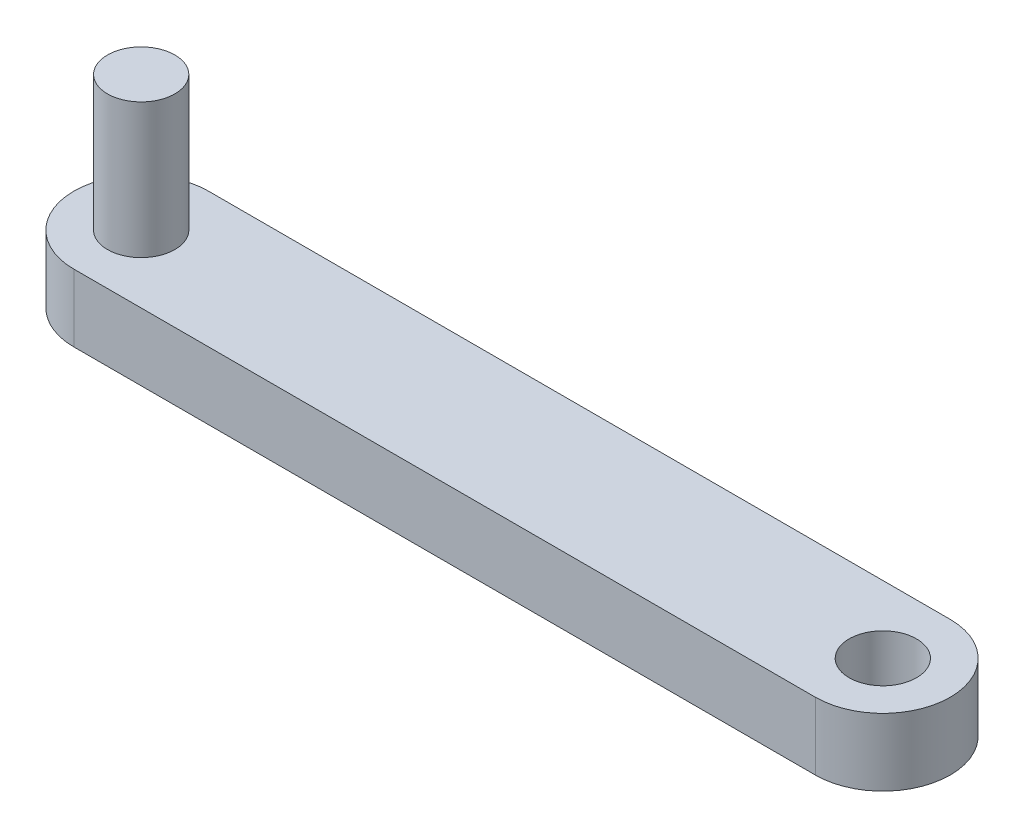
from build123d import *

# Parameters (mm, degrees)
SKETCH1_R                = 5
BOSS_EXTRUDE1_DEPTH      = 5
BOSS_EXTRUDE2_DEPTH      = 25
BOSS_EXTRUDE2_DEPTH_BACK = 5
SKETCH2_R                = 5


with BuildPart() as part:
    # Sketch1 → Boss-Extrude1 (new, symmetric)
    with BuildSketch(Plane(origin=(0, 0, 0), x_dir=(1, 0, 0), z_dir=(0, 1, 0))):
        with BuildLine():
            Line((-55, -10), (55, -10))
            ThreePointArc((55, -10), (65, 0), (55, 10))
            Line((55, 10), (-55, 10))
            ThreePointArc((-55, 10), (-65, 0), (-55, -10))
        make_face()
        with Locations(Location((-55, 0, 0), (0, 0, 270))):
            Circle(SKETCH1_R, mode=Mode.SUBTRACT)
        with Locations(Location((55, 0, 0), (0, 0, 270))):
            Circle(SKETCH1_R, mode=Mode.SUBTRACT)
    extrude(amount=BOSS_EXTRUDE1_DEPTH, both=True)

    # Sketch2 → Boss-Extrude2 (add, two sides: drawn at the far end of the back side and taken through both)
    with BuildSketch(Plane(origin=(0, 0, 0), x_dir=(1, 0, 0), z_dir=(0, 1, 0)).offset(-BOSS_EXTRUDE2_DEPTH_BACK)):
        with Locations(Location((-55, 0, 0), (0, 0, 270))):
            Circle(SKETCH2_R)
    extrude(amount=BOSS_EXTRUDE2_DEPTH + BOSS_EXTRUDE2_DEPTH_BACK)


solid = part.part
